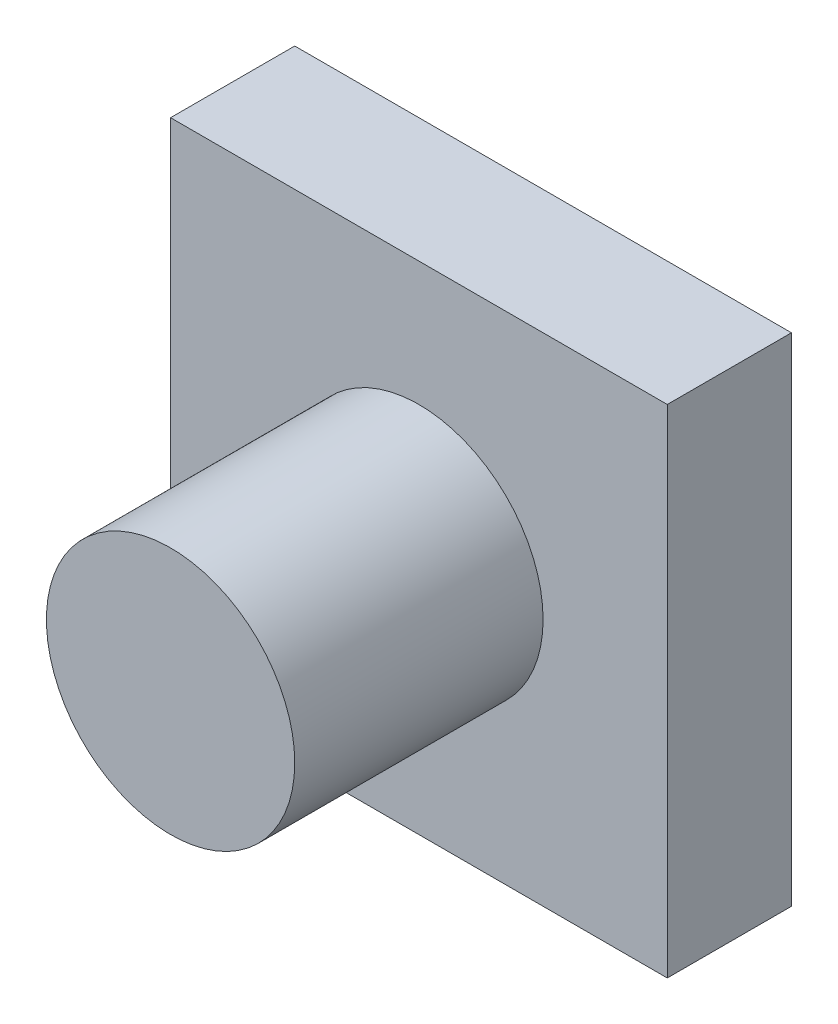
from build123d import *

# Parameters (mm, degrees)
ESQUISSE1_W        = 40
ESQUISSE1_H        = 40
BOSS_EXTRU_3_DEPTH = 10
ESQUISSE2_R        = 10
BOSS_EXTRU_4_DEPTH = 20


with BuildPart() as part:
    # Esquisse1 → Boss.-Extru.3 (new body)
    with BuildSketch(Plane.XY):
        Rectangle(ESQUISSE1_W, ESQUISSE1_H)
    extrude(amount=BOSS_EXTRU_3_DEPTH)

    # Esquisse2 → Boss.-Extru.4 (add)
    with BuildSketch(Plane.XY.offset(10)):
        Circle(ESQUISSE2_R)
    extrude(amount=BOSS_EXTRU_4_DEPTH)


solid = part.part
